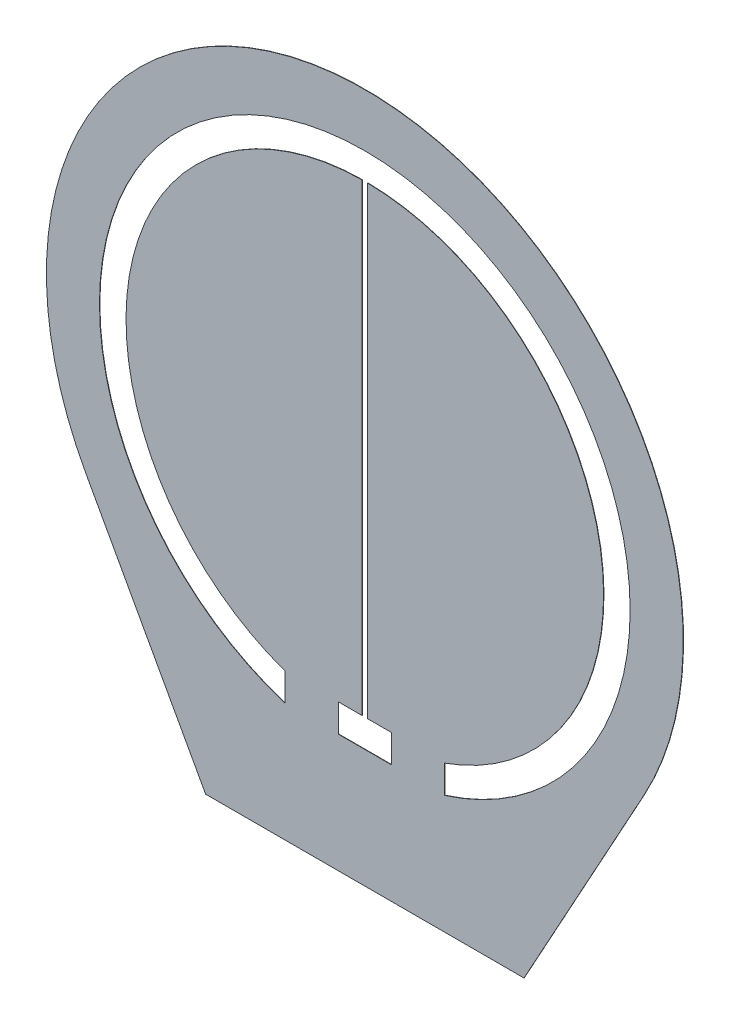
from build123d import *

# Parameters (mm, degrees)
BOSS_EXTRUDE1_DEPTH = 0.03556


with BuildPart() as part:
    # Sketch2 → Boss-Extrude1 (new body)
    with BuildSketch(Plane.XY):
        with BuildLine():
            Line((-7.5, -35.000000035), (0, -35.000000035))
            Line((0, -35.000000035), (7.5, -35.000000035))
            Line((7.5, -35.000000035), (15, -35.000000035))
            Line((15, -35.000000035), (26.292884658, -14.44590656))
            ThreePointArc((26.292884658, -14.44590656), (0, 30), (-26.292884658, -14.44590656))
            Line((-26.292884658, -14.44590656), (-15, -35.000000035))
            Line((-15, -35.000000035), (-7.5, -35.000000035))
        make_face()
        with BuildLine():
            Line((0.25, 22.498611068), (0.25, -21.213203436))
            Line((0.25, -21.213203436), (2.5, -21.213203436))
            Line((2.5, -21.213203436), (2.5, -23.848480036))
            Line((2.5, -23.848480036), (-2.5, -23.848480036))
            Line((-2.5, -23.848480036), (-2.5, -21.213203436))
            Line((-2.5, -21.213203436), (-0.25, -21.213203436))
            Line((-0.25, -21.213203436), (-0.25, 22.498611068))
            ThreePointArc((-0.25, 22.498611068), (-22.196763431, 3.681534082), (-7.5, -21.213203436))
            Line((-7.5, -21.213203436), (-7.5, -23.848480035))
            ThreePointArc((-7.5, -23.848480035), (0, 25), (7.5, -23.848480035))
            Line((7.5, -23.848480035), (7.5, -21.213203436))
            ThreePointArc((7.5, -21.213203436), (22.196763431, 3.681534082), (0.25, 22.498611068))
        make_face(mode=Mode.SUBTRACT)
    extrude(amount=BOSS_EXTRUDE1_DEPTH)


solid = part.part
